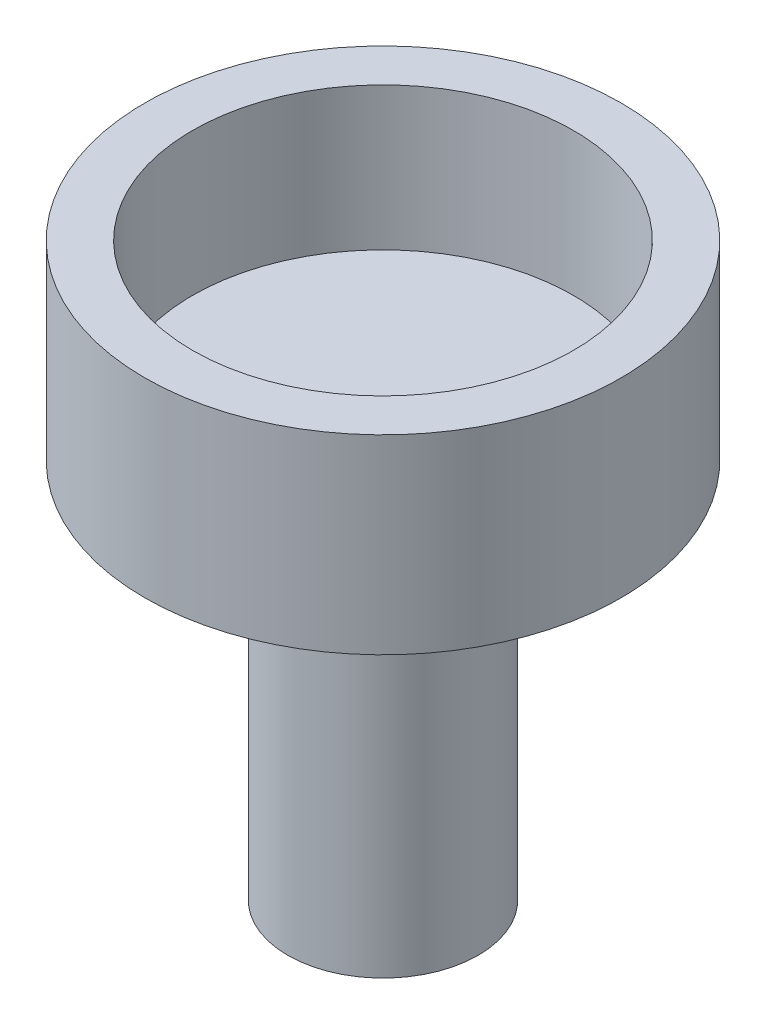
from build123d import *

# Parameters (mm, degrees)
BOTTOMBASES_R     = 1
BOTTOM_BASE_DEPTH = 4
MAINBASES_R       = 2.5
MAIN_BASE_DEPTH   = 0.5
WALLS_R           = 2.5
WALLS_R_2         = 2
WALL_DEPTH        = 1.5


with BuildPart() as part:
    # BottomBaseS → BOTTOM BASE (new body)
    with BuildSketch(Plane(origin=(0, 0, 0), x_dir=(1, 0, 0), z_dir=(0, 1, 0))):
        with Locations(Location((0, 0, 0), (0, 0, 270))):
            Circle(BOTTOMBASES_R)
    extrude(amount=-BOTTOM_BASE_DEPTH)

    # MainBaseS → MAIN BASE (add)
    with BuildSketch(Plane(origin=(0, 0, 0), x_dir=(1, 0, 0), z_dir=(0, 1, 0))):
        with Locations(Location((0, 0, 0), (0, 0, 270))):
            Circle(MAINBASES_R)
    extrude(amount=MAIN_BASE_DEPTH)

    # WallS → WALL (add)
    with BuildSketch(Plane(origin=(0, 0.5, 0), x_dir=(1, 0, 0), z_dir=(0, 1, 0))):
        with Locations(Location((0, 0, 0), (0, 0, 270))):
            Circle(WALLS_R)
        with Locations(Location((0, 0, 0), (0, 0, 270))):
            Circle(WALLS_R_2, mode=Mode.SUBTRACT)
    extrude(amount=WALL_DEPTH)


solid = part.part
